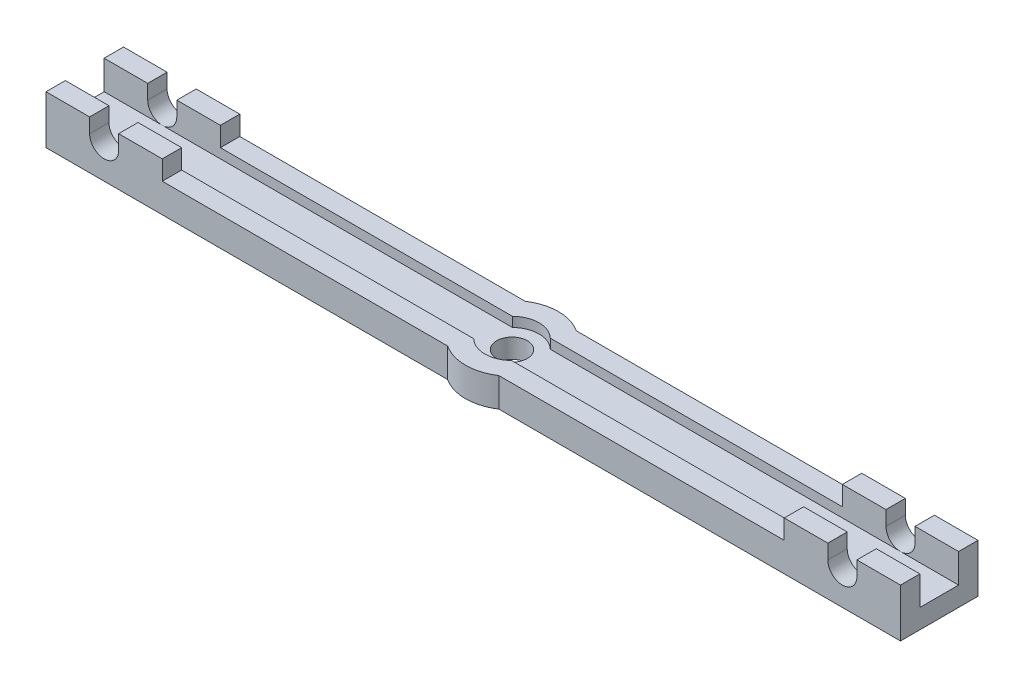
from build123d import *

# Parameters (mm, degrees)
SKETCH1_W           = 44.1
SKETCH1_H           = 8
BOSS_EXTRUDE1_DEPTH = 2
SKETCH2_W           = 12
SKETCH2_H           = 2
BOSS_EXTRUDE2_DEPTH = 3
CUT_EXTRUDE1_DEPTH  = 46.097782651
SKETCH4_W           = 32.1
SKETCH4_H           = 2
BOSS_EXTRUDE3_DEPTH = 1
SKETCH7_R           = 2.794
CUT_EXTRUDE3_DEPTH  = 45.382541613
SKETCH8_R           = 1.5875
CUT_EXTRUDE4_DEPTH  = 45.382541613
BOSS_EXTRUDE4_DEPTH = 3


with BuildPart() as part:
    # Sketch1 → Boss-Extrude1 (new body)
    with BuildSketch(Plane(origin=(0, 0, 0), x_dir=(1, 0, 0), z_dir=(0, 1, 0))):
        with Locations((22.05, 0)):
            Rectangle(SKETCH1_W, SKETCH1_H)
    boss_extrude1 = extrude(amount=BOSS_EXTRUDE1_DEPTH)

    # Sketch2 → Boss-Extrude2 (add)
    with BuildSketch(Plane(origin=(0, 2, 0), x_dir=(1, 0, 0), z_dir=(0, 1, 0))):
        with Locations((38.1, 3)):
            Rectangle(SKETCH2_W, SKETCH2_H)
        with Locations((38.1, -3)):
            Rectangle(SKETCH2_W, SKETCH2_H)
    boss_extrude2 = extrude(amount=BOSS_EXTRUDE2_DEPTH)

    # Sketch3 → Cut-Extrude1 (cut, through all)
    with BuildSketch(Plane.XY.offset(4)):
        with BuildLine():
            Line((36.6, 3.5), (36.6, 5))
            Line((36.6, 5), (39.6, 5))
            Line((39.6, 5), (39.6, 3.5))
            ThreePointArc((39.6, 3.5), (38.1, 2), (36.6, 3.5))
        make_face()
    cut_extrude1 = extrude(amount=-CUT_EXTRUDE1_DEPTH, mode=Mode.SUBTRACT)

    # Sketch4 → Boss-Extrude3 (add)
    with BuildSketch(Plane(origin=(0, 2, 0), x_dir=(1, 0, 0), z_dir=(0, 1, 0))):
        with Locations((16.05, -3)):
            Rectangle(SKETCH4_W, SKETCH4_H)
        with Locations((16.05, 3)):
            Rectangle(SKETCH4_W, SKETCH4_H)
    boss_extrude3 = extrude(amount=BOSS_EXTRUDE3_DEPTH)

    # Mirror1: Boss-Extrude1, Boss-Extrude2, Cut-Extrude1, Boss-Extrude3 across plane
    add(boss_extrude1.mirror(Plane(origin=(0, 0, 0), x_dir=(0, 0, 1), z_dir=(1, 0, 0))))
    add(boss_extrude2.mirror(Plane(origin=(0, 0, 0), x_dir=(0, 0, 1), z_dir=(1, 0, 0))))
    add(cut_extrude1.mirror(Plane(origin=(0, 0, 0), x_dir=(0, 0, 1), z_dir=(1, 0, 0))), mode=Mode.SUBTRACT)
    add(boss_extrude3.mirror(Plane(origin=(0, 0, 0), x_dir=(0, 0, 1), z_dir=(1, 0, 0))))

    # Sketch7 → Cut-Extrude3 (cut, through all)
    with BuildSketch(Plane(origin=(0, 2, 0), x_dir=(1, 0, 0), z_dir=(0, 1, 0))):
        Circle(SKETCH7_R)
    extrude(amount=CUT_EXTRUDE3_DEPTH, mode=Mode.SUBTRACT)

    # Sketch8 → Cut-Extrude4 (cut, through all)
    with BuildSketch(Plane(origin=(0, 2, 0), x_dir=(1, 0, 0), z_dir=(0, 1, 0))):
        with Locations(Location((0, 0, 0), (0, 0, 270))):
            Circle(SKETCH8_R)
    extrude(amount=-CUT_EXTRUDE4_DEPTH, mode=Mode.SUBTRACT)

    # Sketch9 → Boss-Extrude4 (add)
    with BuildSketch(Plane(origin=(0, 3, 0), x_dir=(1, 0, 0), z_dir=(0, 1, 0))):
        with BuildLine():
            Line((-2.642429942, -4), (2.642429942, -4))
            ThreePointArc((2.642429942, -4), (0, -4.794), (-2.642429942, -4))
        make_face()
        with BuildLine():
            Line((2.642429942, 4), (-2.642429942, 4))
            ThreePointArc((-2.642429942, 4), (0, 4.794), (2.642429942, 4))
        make_face()
    extrude(amount=-BOSS_EXTRUDE4_DEPTH)


solid = part.part
